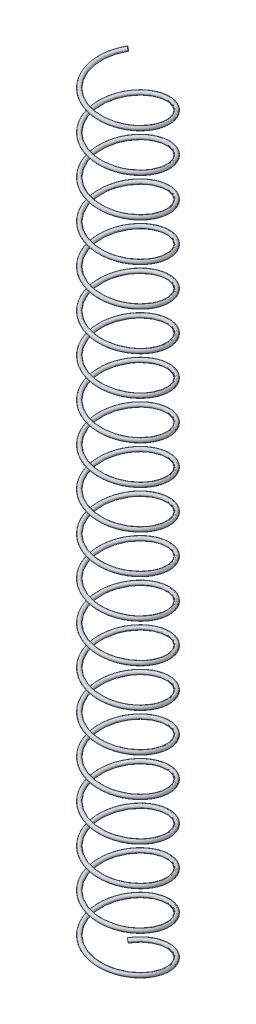
from build123d import *

# Parameters (mm, degrees)
BARRER4_PITCH       = 5.035897929
BARRER4_HEIGHT      = 100.717958571
BARRER4_RADIUS      = 4.5
BARRER4_START_ANGLE = -135
BARRER4_PROFILE_R   = 0.25


with BuildPart() as part:
    # Barrer4: sweep along a helix
    with BuildLine() as barrer4_path:
        add(Helix(BARRER4_PITCH, BARRER4_HEIGHT, BARRER4_RADIUS, center=(0, 0, 0), direction=(0, 1, 0), lefthand=True, mode=Mode.PRIVATE).rotate(Axis((0, 0, 0), (0, 1, 0)), BARRER4_START_ANGLE))
    # Barrer4 profile (on start of the path) → Barrer4 (sweep)
    with BuildSketch(Plane(origin=(-3.181980515, 0, -3.181980515), x_dir=(-0.7071067811865724, 0, -0.7071067811865227), z_dir=(0.6961511190921035, 0.1753489058236637, -0.6961511190921523))):
        Circle(BARRER4_PROFILE_R)
    sweep(path=barrer4_path.line, is_frenet=True)


solid = part.part
